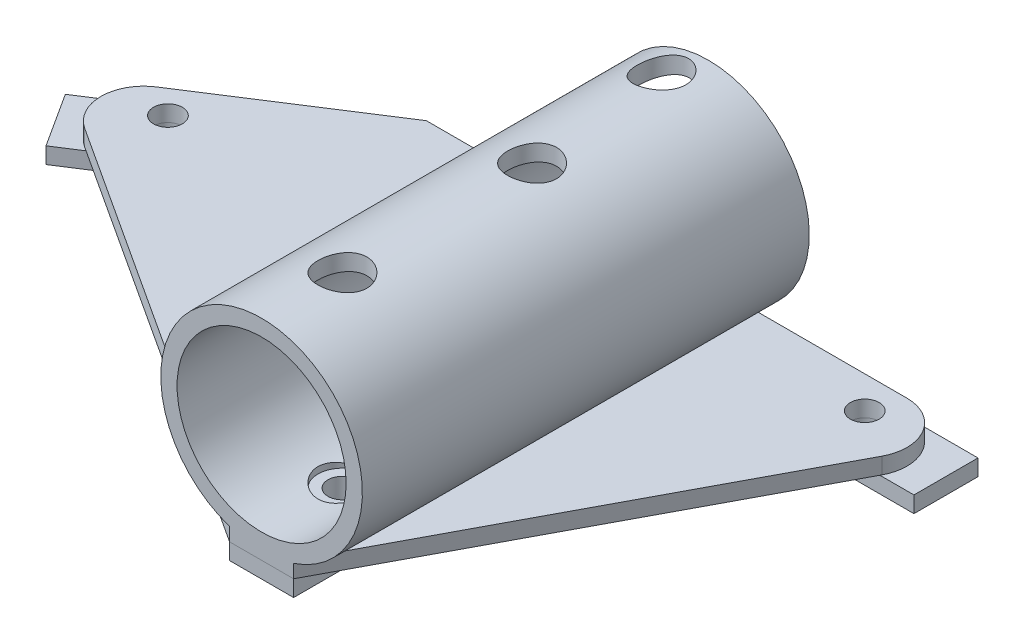
from build123d import *

# Parameters (mm, degrees)
BOSS_EXTRUDE1_DEPTH     = 3.81
BOSS_EXTRUDE2_DEPTH     = 3.81
BOSS_EXTRUDE3_DEPTH     = 3.81
BOSS_EXTRUDE4_DEPTH     = 104.7242
SKETCH2_R               = 3.3782
CUT_EXTRUDE1_DEPTH      = 7.62
CUT_EXTRUDE3_DEPTH      = 45.974
CUT_EXTRUDE3_DEPTH_BACK = 2.54
SKETCH18_R              = 5.715
CUT_EXTRUDE5_DEPTH      = 188.428441235
CUT_EXTRUDE7_DEPTH      = 188.428441235
FILLET1_R               = 10
FILLET2_R               = 10


with BuildPart() as part:
    # Sketch1 → Boss-Extrude1 (new body)
    with BuildSketch(Plane(origin=(0, 0, 0), x_dir=(1, 0, 0), z_dir=(0, 1, 0))):
        Polygon((-94.679884126, 33.093313636), (34.606115874, 33.093313636), (34.606115874, 18.081913636), (-21.057984126, 18.081913636), (-21.057984126, -71.630886364), (-36.069384126, -71.630886364), (-36.069384126, 18.081913636), (-90.057084126, 18.081913636), (-137.953092438, -12.768415824), (-146.142419597, -0.054253981), align=None)
    extrude(amount=BOSS_EXTRUDE1_DEPTH)


with BuildPart() as body_2:
    # Sketch4 → Boss-Extrude2 (new body)
    with BuildSketch(Plane(origin=(0, 3.81, 0), x_dir=(1, 0, 0), z_dir=(0, 1, 0))):
        Polygon((-146.142419597, -0.054253981), (-94.679884126, 33.093313636), (34.606115874, 33.093313636), (-21.057984126, -71.630886364), (-36.069384126, -71.630886364), align=None)
    extrude(amount=BOSS_EXTRUDE2_DEPTH)

    # Sketch9 → Boss-Extrude3 (add)
    with BuildSketch(Plane(origin=(0, 7.62, 0), x_dir=(1, 0, 0), z_dir=(0, 1, 0))):
        with BuildLine():
            Line((-36.069384126, -71.630886364), (-21.057984126, -71.630886364))
            Line((-21.057984126, -71.630886364), (-21.057984126, 18.081913636))
            Line((-21.057984126, 18.081913636), (-21.057984126, 33.093313636))
            Line((-21.057984126, 33.093313636), (-36.069384126, 33.093313636))
            ThreePointArc((-36.069384126, 33.093313636), (-43.575084126, 25.587613636), (-36.069384126, 18.081913636))
            Line((-36.069384126, 18.081913636), (-36.069384126, -71.630886364))
        make_face()
    extrude(amount=BOSS_EXTRUDE3_DEPTH)

    # Sketch13 → Boss-Extrude4 (add, through all)
    with BuildSketch(Plane.XY.offset(71.630886364)):
        with BuildLine():
            Line((-36.069384126, 11.001793115), (-36.069384126, 6.939157436))
            ThreePointArc((-36.069384126, 6.939157436), (-28.563684126, 52.959), (-21.057984126, 6.939157436))
            Line((-21.057984126, 6.939157436), (-21.057984126, 11.001793115))
            ThreePointArc((-21.057984126, 11.001793115), (-28.563684126, 49.149), (-36.069384126, 11.001793115))
        make_face()
    extrude(amount=-BOSS_EXTRUDE4_DEPTH)


with BuildPart() as cut_extrude1_tool:
    # Sketch2 → Cut-Extrude1 (new, symmetric)
    with BuildSketch(Plane(origin=(0, 3.81, 0), x_dir=(1, 0, 0), z_dir=(0, 1, 0))):
        with Locations(Location((-125.995262913, 3.846573254, 0), (0, 0, 90))):
            Circle(SKETCH2_R)
        with Locations(Location((-75.096484126, 25.574913636, 0), (0, 0, 90))):
            Circle(SKETCH2_R)
        with Locations(Location((-32.043484126, 25.574913636, 0), (0, 0, 90))):
            Circle(SKETCH2_R)
        with Locations(Location((15.581515874, 25.574913636, 0), (0, 0, 90))):
            Circle(SKETCH2_R)
        with Locations(Location((-28.677984126, -8.130886364, 0), (0, 0, 90))):
            Circle(SKETCH2_R)
        with Locations(Location((-28.677984126, -52.580886364, 0), (0, 0, 90))):
            Circle(SKETCH2_R)
    extrude(amount=CUT_EXTRUDE1_DEPTH, both=True)


with BuildPart() as part_1:
    add(part.part)

    # Cut-Extrude1: cut by cut_extrude1_tool
    add(cut_extrude1_tool.part, mode=Mode.SUBTRACT)


with BuildPart() as body_2_1:
    add(body_2.part)

    # Cut-Extrude1: cut by cut_extrude1_tool
    add(cut_extrude1_tool.part, mode=Mode.SUBTRACT)

    # Sketch18 → Cut-Extrude3 (cut, two sides: drawn at the far end of the back side and taken through both)
    with BuildSketch(Plane(origin=(0, 11.43, 0), x_dir=(1, 0, 0), z_dir=(0, 1, 0)).offset(-CUT_EXTRUDE3_DEPTH_BACK)):
        with Locations(Location((-28.677984126, -52.580886364, 0), (0, 0, 270))):
            Circle(SKETCH18_R)
        with Locations(Location((-28.677984126, -8.130886364, 0), (0, 0, 270))):
            Circle(SKETCH18_R)
        with Locations(Location((-32.043484126, 25.574913636, 0), (0, 0, 150.968233854))):
            Circle(SKETCH18_R)
    extrude(amount=CUT_EXTRUDE3_DEPTH + CUT_EXTRUDE3_DEPTH_BACK, mode=Mode.SUBTRACT)

    # Sketch20 → Cut-Extrude5 (cut, through all)
    with BuildSketch(Plane.XY.offset(71.630886364)):
        with BuildLine():
            Line((-37.040398997, 11.43), (-20.086969256, 11.43))
            ThreePointArc((-20.086969256, 11.43), (-28.563684126, 9.525), (-37.040398997, 11.43))
        make_face()
    extrude(amount=-CUT_EXTRUDE5_DEPTH, mode=Mode.SUBTRACT)

    # Sketch21 → Cut-Extrude7 (cut, through all)
    with BuildSketch(Plane.XY.offset(71.630886364)):
        with BuildLine():
            Line((-43.575084126, 7.62), (-37.857273046, 7.62))
            ThreePointArc((-37.857273046, 7.62), (-40.839980424, 9.155537386), (-43.575084126, 11.098119715))
            Line((-43.575084126, 11.098119715), (-43.575084126, 9.359059858))
            Line((-43.575084126, 9.359059858), (-43.575084126, 7.62))
        make_face()
    extrude(amount=-CUT_EXTRUDE7_DEPTH, mode=Mode.SUBTRACT)

    # Fillet1
    fillet1_edges = [body_2_1.edges().sort_by_distance(p)[0] for p in [
        (34.606115874, 5.715, -33.093313636),
    ]]
    fillet(fillet1_edges, radius=FILLET1_R)

    # Fillet2
    fillet2_edges = [body_2_1.edges().sort_by_distance(p)[0] for p in [
        (-146.142419597, 5.715, 0.054253981),
    ]]
    fillet(fillet2_edges, radius=FILLET2_R)


solid = Compound([part_1.part, body_2_1.part])
